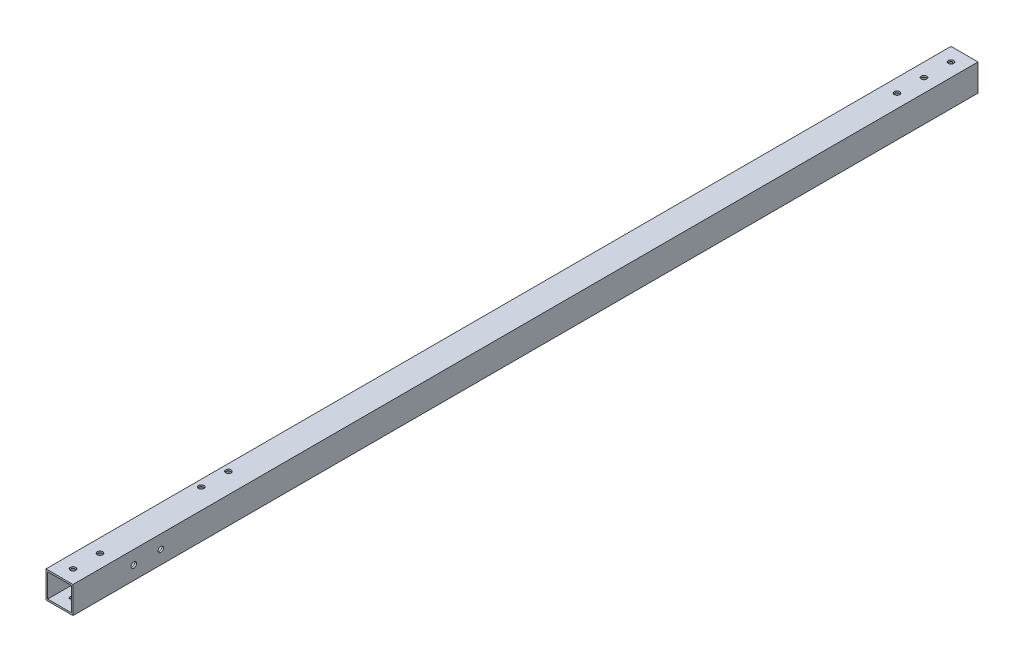
from build123d import *

# Parameters (mm, degrees)
SKETCH1_W           = 25.4
SKETCH1_H           = 25.4
SKETCH1_W_2         = 22.225
SKETCH1_H_2         = 22.225
BOSS_EXTRUDE1_DEPTH = 850.9
SKETCH3_R           = 2.54
CUT_EXTRUDE2_DEPTH  = 852.657871448
SKETCH4_R           = 2.54
CUT_EXTRUDE3_DEPTH  = 852.657871448


with BuildPart() as part:
    # Sketch1 → Boss-Extrude1 (new body)
    with BuildSketch(Plane.XY):
        with Locations((12.7, 12.7)):
            Rectangle(SKETCH1_W, SKETCH1_H)
        with Locations((12.7, 12.7)):
            Rectangle(SKETCH1_W_2, SKETCH1_H_2, mode=Mode.SUBTRACT)
    extrude(amount=BOSS_EXTRUDE1_DEPTH)

    # Sketch3 → Cut-Extrude2 (cut, through all)
    with BuildSketch(Plane(origin=(0, 25.4, 0), x_dir=(1, 0, 0), z_dir=(0, 1, 0))):
        with Locations(Location((12.7, -812.8, 0), (0, 0, 90))):
            Circle(SKETCH3_R)
        with Locations(Location((12.7, -838.2, 0), (0, 0, 90))):
            Circle(SKETCH3_R)
        with Locations(Location((12.7, -12.7, 0), (0, 0, 270))):
            Circle(SKETCH3_R)
        with Locations(Location((12.7, -38.1, 0), (0, 0, 270))):
            Circle(SKETCH3_R)
        with Locations(Location((12.7, -63.5, 0), (0, 0, 270))):
            Circle(SKETCH3_R)
        with Locations(Location((6.35, -711.2, 0), (0, 0, 270))):
            Circle(SKETCH3_R)
        with Locations(Location((6.35, -685.8, 0), (0, 0, 270))):
            Circle(SKETCH3_R)
    extrude(amount=-CUT_EXTRUDE2_DEPTH, mode=Mode.SUBTRACT)

    # Sketch4 → Cut-Extrude3 (cut, through all)
    with BuildSketch(Plane(origin=(25.4, 0, 0), x_dir=(0, 0, -1), z_dir=(1, 0, 0))):
        with Locations((-793.75, 12.7)):
            Circle(SKETCH4_R)
        with Locations((-768.35, 12.7)):
            Circle(SKETCH4_R)
    extrude(amount=-CUT_EXTRUDE3_DEPTH, mode=Mode.SUBTRACT)


solid = part.part
